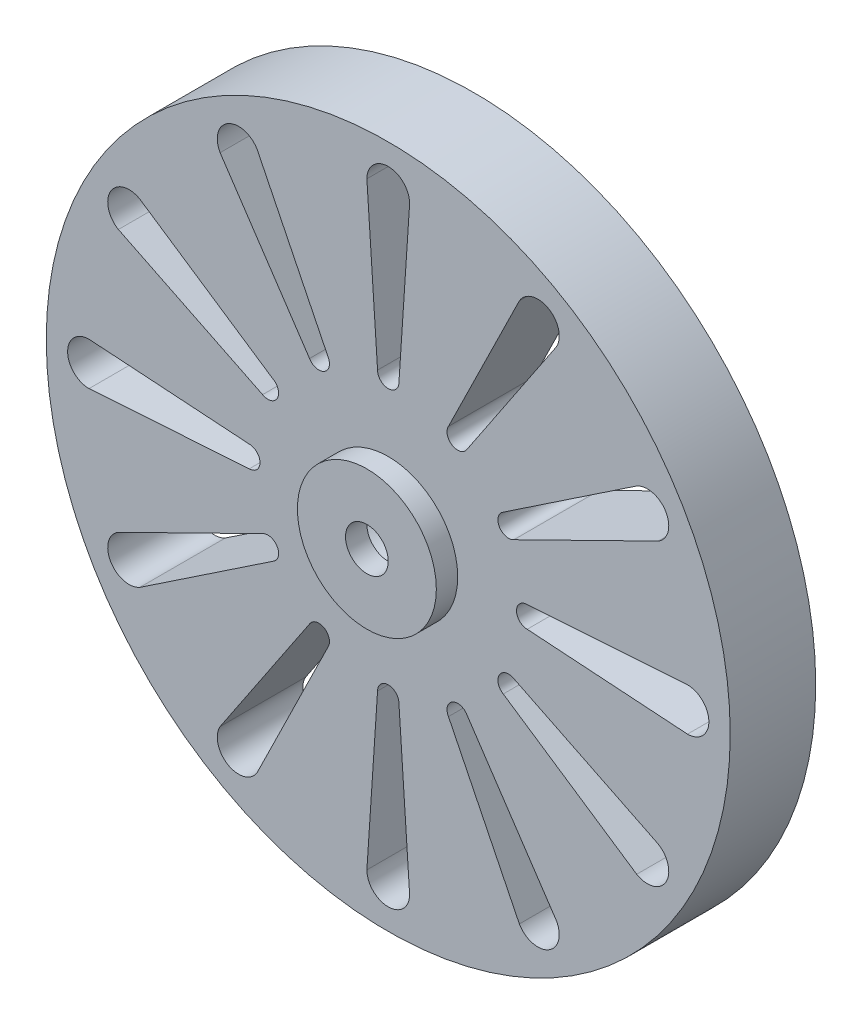
from build123d import *

# Parameters (mm, degrees)
ESQUISSE1_R                  = 16
BOSS_EXTRU_1_DEPTH           = 4
ESQUISSE2_R                  = 3.25
BOSS_EXTRU_2_DEPTH           = 1
ENL_V_MAT_EXTRU_1_REACH      = 25.173
ESQUISSE3_R                  = 1
ENL_V_MAT_EXTRU_2_DEPTH      = 4
ENL_V_MAT_EXTRU_4_REACH      = 25.173
R_P_TITION_CIRCULAIRE1_COUNT = 12


with BuildPart() as part:
    # Esquisse1 → Boss.-Extru.1 (new body)
    with BuildSketch(Plane.XY):
        Circle(ESQUISSE1_R)
    extrude(amount=BOSS_EXTRU_1_DEPTH)

    # Esquisse2 → Boss.-Extru.2 (add)
    with BuildSketch(Plane.XY.offset(4)):
        Circle(ESQUISSE2_R)
    extrude(amount=BOSS_EXTRU_2_DEPTH)

    # Esquisse3 → Enlèv. mat.-Extru.1 (cut, up to next)
    with BuildSketch(Plane.XY.offset(5), mode=Mode.PRIVATE) as enl_v_mat_extru_1_sk1:
        Circle(ESQUISSE3_R)
    enl_v_mat_extru_1_tool1 = extrude(enl_v_mat_extru_1_sk1.sketch, amount=-ENL_V_MAT_EXTRU_1_REACH, mode=Mode.PRIVATE) & part.part
    add(enl_v_mat_extru_1_tool1.solids().sort_by_distance((0, 0, 5))[0], mode=Mode.SUBTRACT)

    # Esquisse4 → Enlèv. mat.-Extru.2 (cut)
    with BuildSketch(Plane(origin=(0, 0, 0), x_dir=(-1, 0, 0), z_dir=(0, 0, -1))):
        with BuildLine():
            Line((-0.925, 1.85), (0.925, 1.85))
            ThreePointArc((0.925, 1.85), (2.775, 0), (0.925, -1.85))
            Line((0.925, -1.85), (-0.925, -1.85))
            ThreePointArc((-0.925, -1.85), (-2.775, 0), (-0.925, 1.85))
        make_face()
    extrude(amount=-ENL_V_MAT_EXTRU_2_DEPTH, mode=Mode.SUBTRACT)

    # Esquisse5 → Enlèv. mat.-Extru.4 (cut, up to next)
    with BuildSketch(Plane(origin=(0, 0, 0), x_dir=(-1, 0, 0), z_dir=(0, 0, -1)), mode=Mode.PRIVATE) as enl_v_mat_extru_4_sk1:
        with BuildLine():
            Line((6.5, 0.5), (14, 1))
            ThreePointArc((14, 1), (15, 0), (14, -1))
            Line((14, -1), (6.5, -0.5))
            ThreePointArc((6.5, -0.5), (6, 0), (6.5, 0.5))
        make_face()
    enl_v_mat_extru_4_tool1 = extrude(enl_v_mat_extru_4_sk1.sketch, amount=-ENL_V_MAT_EXTRU_4_REACH, mode=Mode.PRIVATE) & part.part
    enl_v_mat_extru_4 = enl_v_mat_extru_4_tool1.solids().sort_by_distance((-10.983243, 0, 0))[0]
    add(enl_v_mat_extru_4, mode=Mode.SUBTRACT)

    # Répétition circulaire1: Enlèv. mat.-Extru.4 ×12 about axis
    r_p_tition_circulaire1_axis = Axis((0, 0, 0), (0, 0, 1))
    for i in range(1, R_P_TITION_CIRCULAIRE1_COUNT):
        add(enl_v_mat_extru_4.rotate(r_p_tition_circulaire1_axis, i * 360 / R_P_TITION_CIRCULAIRE1_COUNT), mode=Mode.SUBTRACT)


solid = part.part
